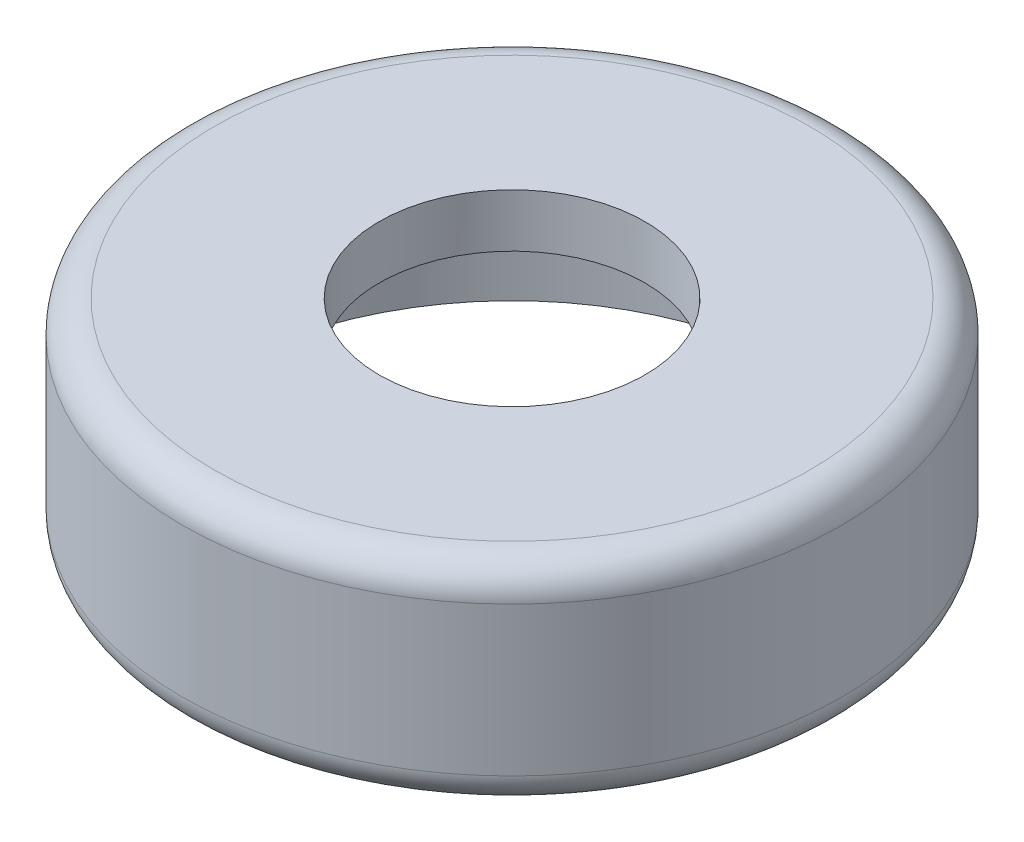
from build123d import *

# Parameters (mm, degrees)
SKETCH1_R               = 31
BOSS_EXTRUDE1_DEPTH     = 20
FILLET1_R               = 3
SKETCH2_R               = 28
CUT_EXTRUDE1_DEPTH      = 15
CUT_EXTRUDE2_DEPTH      = 49.187135341
CUT_EXTRUDE2_DEPTH_BACK = 49.187135341
SKETCH3_R               = 12.5


with BuildPart() as part:
    # Sketch1 → Boss-Extrude1 (new body)
    with BuildSketch(Plane(origin=(0, 0, 0), x_dir=(1, 0, 0), z_dir=(0, 1, 0))):
        with Locations(Location((0, 0, 0), (0, 0, 270))):
            Circle(SKETCH1_R)
    extrude(amount=BOSS_EXTRUDE1_DEPTH)

    # Fillet1
    fillet1_edges = [part.edges().sort_by_distance(p)[0] for p in [
        (0, 0, -31),
        (0, 20, -31),
    ]]
    fillet(fillet1_edges, radius=FILLET1_R)

    # Sketch2 → Cut-Extrude1 (cut)
    with BuildSketch(Plane.XZ):
        with Locations(Location((0, 0, 0), (0, 0, 270))):
            Circle(SKETCH2_R)
    extrude(amount=-CUT_EXTRUDE1_DEPTH, mode=Mode.SUBTRACT)

    # Sketch3 → Cut-Extrude2 (cut, two sides: drawn at the far end of the back side and taken through both)
    with BuildSketch(Plane(origin=(0, 20, 0), x_dir=(1, 0, 0), z_dir=(0, 1, 0)).offset(-CUT_EXTRUDE2_DEPTH_BACK)):
        with Locations(Location((0, 0, 0), (0, 0, 270))):
            Circle(SKETCH3_R)
    extrude(amount=CUT_EXTRUDE2_DEPTH + CUT_EXTRUDE2_DEPTH_BACK, mode=Mode.SUBTRACT)


solid = part.part
